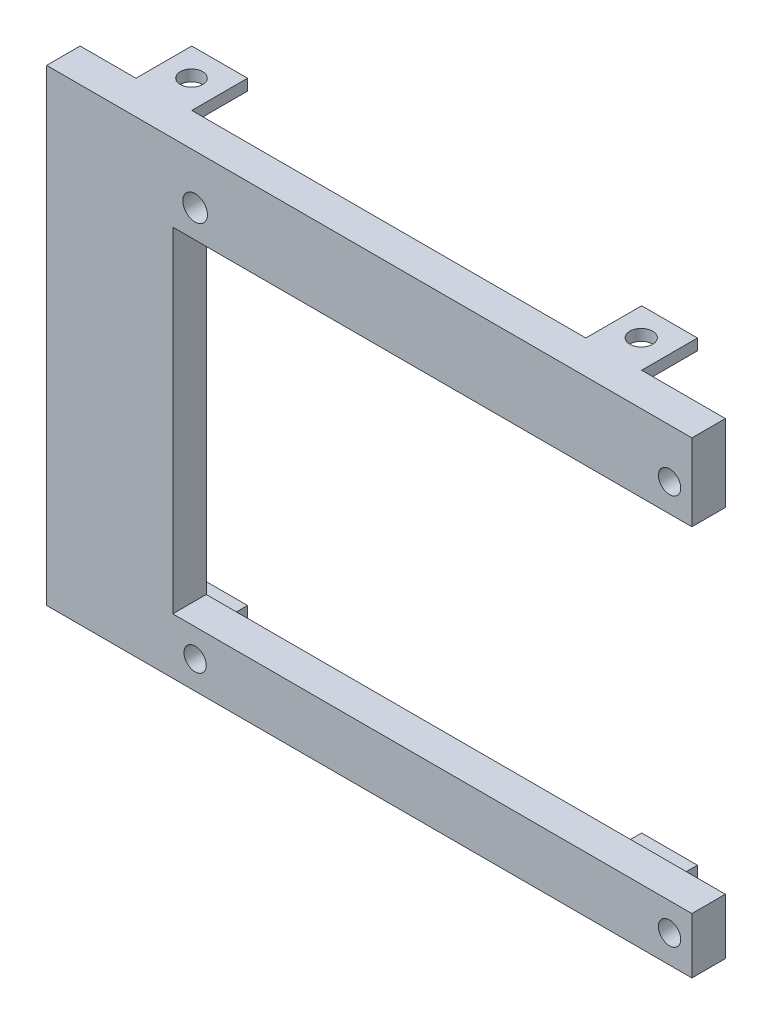
from build123d import *

# Parameters (mm, degrees)
EXTRUDE_1_DEPTH     = 6
SKETCH_2_W          = 10
SKETCH_2_H          = 2
EXTRUDE_2_DEPTH     = 10
SKETCH_3_W          = 10
SKETCH_3_H          = 2
EXTRUDE_3_DEPTH     = 10
SKETCH_4_R          = 2.040020597
SKETCH_4_R_2        = 2
CUT_EXTRUDE_1_DEPTH = 9
CUT_EXTRUDE_START   = -9
SKETCH_5_R          = 2
CUT_EXTRUDE_2_DEPTH = 9
SKETCH_7_R          = 2.206948318
SKETCH_7_R_2        = 2
SKETCH_7_R_3        = 2.004801963
CUT_EXTRUDE_3_DEPTH = 9


with BuildPart() as part:
    # 草图1 → 凸台-拉伸1 (new body)
    with BuildSketch(Plane.XY):
        Polygon((-405.306796117, 348.186737633), (-520.906796117, 348.186737633), (-520.906796117, 264.386737633), (-405.306796117, 264.386737633), (-405.306796117, 274.386737633), (-498.306796117, 274.386737633), (-498.306796117, 334.386737633), (-405.306796117, 334.386737633), align=None)
    extrude(amount=-EXTRUDE_1_DEPTH)

    # 草图2 → 凸台-拉伸2 (add)
    with BuildSketch(Plane(origin=(0, 0, -6), x_dir=(-1, 0, 0), z_dir=(0, 0, -1))):
        with Locations((505.906796117, 347.186737633)):
            Rectangle(SKETCH_2_W, SKETCH_2_H)
        with Locations((505.906796117, 265.386737633)):
            Rectangle(SKETCH_2_W, SKETCH_2_H)
    extrude(amount=EXTRUDE_2_DEPTH)

    # 草图3 → 凸台-拉伸3 (add)
    with BuildSketch(Plane(origin=(0, 0, -6), x_dir=(-1, 0, 0), z_dir=(0, 0, -1))):
        with Locations((425.306796117, 347.186737633)):
            Rectangle(SKETCH_3_W, SKETCH_3_H)
        with Locations((425.306796117, 265.386737633)):
            Rectangle(SKETCH_3_W, SKETCH_3_H)
    extrude(amount=EXTRUDE_3_DEPTH)

    # 草图4 → 切除-拉伸1 (cut)
    with BuildSketch(Plane(origin=(0, 348.186737633, 0), x_dir=(1, 0, 0), z_dir=(0, 1, 0))):
        with Locations(Location((-425.380170541, 11, 0), (0, 0, 270))):
            Circle(SKETCH_4_R)
        with Locations(Location((-505.95276467, 11, 0), (0, 0, 270))):
            Circle(SKETCH_4_R_2)
    extrude(amount=-CUT_EXTRUDE_1_DEPTH, mode=Mode.SUBTRACT)

    # 草图5 → 切除-拉伸2 (cut)
    with BuildSketch(Plane.XZ.offset(-264.386737633).offset(CUT_EXTRUDE_START)):
        with Locations(Location((-505.95276467, -11, 0), (0, 0, 90))):
            Circle(SKETCH_5_R)
        with Locations(Location((-425.380170541, -11, 0), (0, 0, 270))):
            Circle(SKETCH_5_R)
    extrude(amount=CUT_EXTRUDE_2_DEPTH, mode=Mode.SUBTRACT)

    # 草图7 → 切除-拉伸3 (cut)
    with BuildSketch(Plane.XY):
        with Locations((-494.306796117, 339.386737633)):
            Circle(SKETCH_7_R)
        with Locations((-409.306796117, 339.386737633)):
            Circle(SKETCH_7_R_2)
        with Locations((-409.306796117, 269.386737633)):
            Circle(SKETCH_7_R_3)
        with Locations((-494.306796117, 269.386737633)):
            Circle(SKETCH_7_R_2)
    extrude(amount=-CUT_EXTRUDE_3_DEPTH, mode=Mode.SUBTRACT)


solid = part.part
